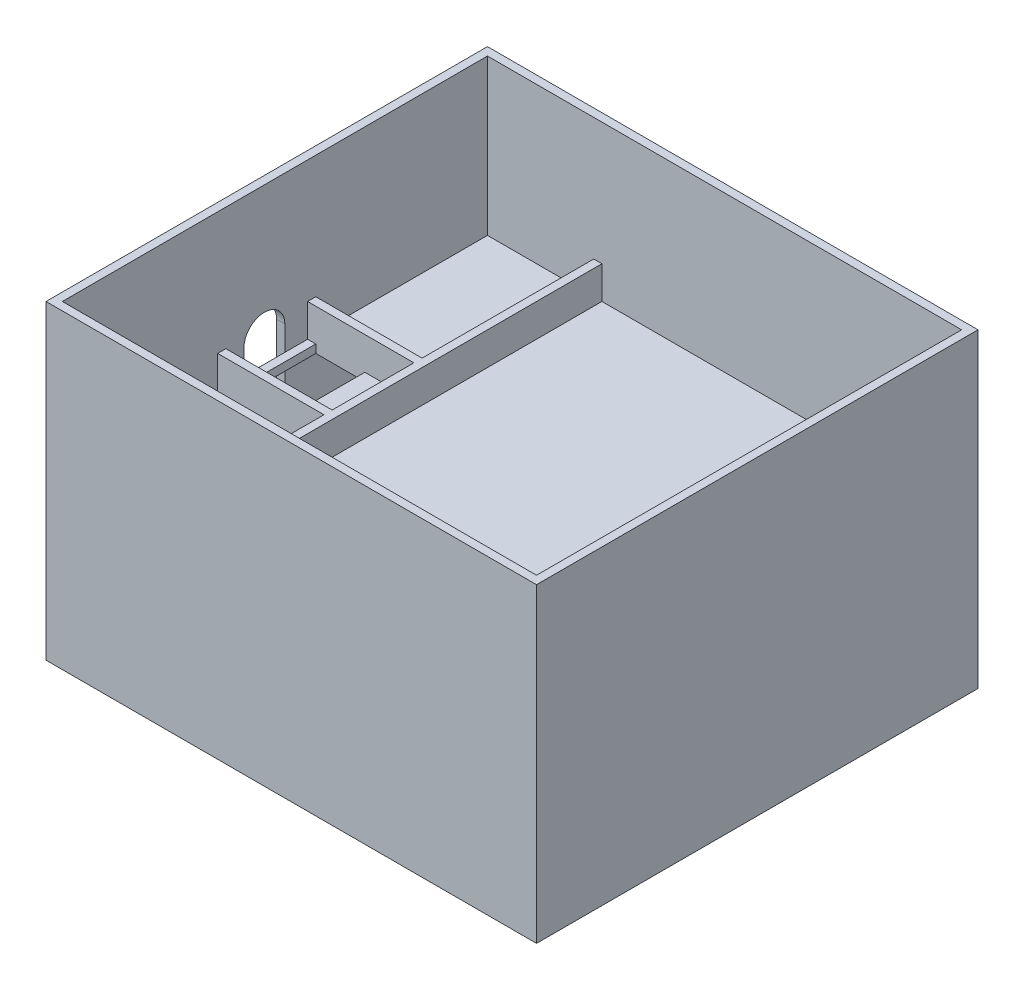
from build123d import *

# Parameters (mm, degrees)
SKETCH1_W           = 60
SKETCH1_H           = 54
BOSS_EXTRUDE1_DEPTH = 38
SKETCH2_W           = 44
SKETCH2_H           = 52
CUT_EXTRUDE1_DEPTH  = 19
SKETCH3_W           = 35
SKETCH3_H           = 52
CUT_EXTRUDE2_DEPTH  = 18
SKETCH4_W           = 6
SKETCH4_H           = 10
CUT_EXTRUDE3_DEPTH  = 38
SKETCH5_W           = 14
SKETCH5_H           = 52
CUT_EXTRUDE5_DEPTH  = 15
SKETCH6_W           = 13
SKETCH6_H           = 52
CUT_EXTRUDE6_DEPTH  = 4
SKETCH8_W           = 15
SKETCH8_H           = 13
CUT_EXTRUDE7_DEPTH  = 6
SKETCH10_W          = 13
SKETCH10_H          = 5
CUT_EXTRUDE8_DEPTH  = 6
SKETCH11_W          = 4
SKETCH11_H          = 5
CUT_EXTRUDE9_DEPTH  = 3
SKETCH12_W          = 5
SKETCH12_H          = 2
CUT_EXTRUDE10_DEPTH = 13
CUT_EXTRUDE11_DEPTH = 1
SKETCH14_W          = 13
SKETCH14_H          = 1
BOSS_EXTRUDE2_DEPTH = 4
SKETCH15_W          = 13
SKETCH15_H          = 1
BOSS_EXTRUDE3_DEPTH = 4


with BuildPart() as part:
    # Sketch1 → Boss-Extrude1 (new body)
    with BuildSketch(Plane(origin=(0, 0, 0), x_dir=(1, 0, 0), z_dir=(0, 1, 0))):
        with Locations((-83.874465942, -33.946435202)):
            Rectangle(SKETCH1_W, SKETCH1_H)
    extrude(amount=BOSS_EXTRUDE1_DEPTH)

    # Sketch2 → Cut-Extrude1 (cut)
    with BuildSketch(Plane(origin=(0, 38, 0), x_dir=(1, 0, 0), z_dir=(0, 1, 0))):
        with Locations((-76.874465942, -33.946435202)):
            Rectangle(SKETCH2_W, SKETCH2_H)
    extrude(amount=-CUT_EXTRUDE1_DEPTH, mode=Mode.SUBTRACT)

    # Sketch3 → Cut-Extrude2 (cut)
    with BuildSketch(Plane(origin=(0, 0, 0), x_dir=(-1, 0, 0), z_dir=(0, -1, 0))):
        with Locations((95.374465942, -33.946435202)):
            Rectangle(SKETCH3_W, SKETCH3_H)
    extrude(amount=-CUT_EXTRUDE2_DEPTH, mode=Mode.SUBTRACT)

    # Sketch4 → Cut-Extrude3 (cut)
    with BuildSketch(Plane(origin=(0, 18, 0), x_dir=(-1, 0, 0), z_dir=(0, -1, 0))):
        with Locations((108.874465942, -34.946435202)):
            Rectangle(SKETCH4_W, SKETCH4_H)
    extrude(amount=-CUT_EXTRUDE3_DEPTH, mode=Mode.SUBTRACT)

    # Sketch5 → Cut-Extrude5 (cut)
    with BuildSketch(Plane(origin=(0, 38, 0), x_dir=(1, 0, 0), z_dir=(0, 1, 0))):
        with Locations((-105.874465942, -33.946435202)):
            Rectangle(SKETCH5_W, SKETCH5_H)
    extrude(amount=-CUT_EXTRUDE5_DEPTH, mode=Mode.SUBTRACT)

    # Sketch6 → Cut-Extrude6 (cut)
    with BuildSketch(Plane(origin=(0, 23, 0), x_dir=(1, 0, 0), z_dir=(0, 1, 0))):
        with Locations((-106.374465942, -33.946435202)):
            Rectangle(SKETCH6_W, SKETCH6_H)
    extrude(amount=-CUT_EXTRUDE6_DEPTH, mode=Mode.SUBTRACT)

    # Sketch8 → Cut-Extrude7 (cut)
    with BuildSketch(Plane(origin=(0, 0, 0), x_dir=(-1, 0, 0), z_dir=(0, -1, 0))):
        with Locations((65.874465942, -17.946435202)):
            Rectangle(SKETCH8_W, SKETCH8_H)
    extrude(amount=-CUT_EXTRUDE7_DEPTH, mode=Mode.SUBTRACT)

    # Sketch10 → Cut-Extrude8 (cut)
    with BuildSketch(Plane(origin=(-73.374465942, 0, 0), x_dir=(0, 0, -1), z_dir=(1, 0, 0))):
        with Locations((-17.946435202, 3.5)):
            Rectangle(SKETCH10_W, SKETCH10_H)
    extrude(amount=-CUT_EXTRUDE8_DEPTH, mode=Mode.SUBTRACT)

    # Sketch11 → Cut-Extrude9 (cut)
    with BuildSketch(Plane.XZ):
        with Locations((-65.874465942, 48.446435202)):
            Rectangle(SKETCH11_W, SKETCH11_H)
    extrude(amount=-CUT_EXTRUDE9_DEPTH, mode=Mode.SUBTRACT)

    # Sketch12 → Cut-Extrude10 (cut)
    with BuildSketch(Plane(origin=(-67.874465942, 0, 0), x_dir=(0, 0, -1), z_dir=(1, 0, 0))):
        with Locations((-48.446435202, 2)):
            Rectangle(SKETCH12_W, SKETCH12_H)
    extrude(amount=-CUT_EXTRUDE10_DEPTH, mode=Mode.SUBTRACT)

    # Sketch13 → Cut-Extrude11 (cut)
    with BuildSketch(Plane.ZY.offset(113.874465942)):
        with BuildLine():
            Line((32.733045904, 15), (32.733045904, 22))
            ThreePointArc((32.733045904, 22), (35.233045904, 24.5), (37.733045904, 22))
            Line((37.733045904, 22), (37.733045904, 15))
            ThreePointArc((37.733045904, 15), (35.233045904, 12.5), (32.733045904, 15))
        make_face()
    extrude(amount=-CUT_EXTRUDE11_DEPTH, mode=Mode.SUBTRACT)

    # Sketch14 → Boss-Extrude2 (add)
    with BuildSketch(Plane(origin=(0, 19, 0), x_dir=(1, 0, 0), z_dir=(0, 1, 0))):
        with Locations((-106.374465942, -40.446435202)):
            Rectangle(SKETCH14_W, SKETCH14_H)
    extrude(amount=BOSS_EXTRUDE2_DEPTH)

    # Sketch15 → Boss-Extrude3 (add)
    with BuildSketch(Plane(origin=(0, 19, 0), x_dir=(1, 0, 0), z_dir=(0, 1, 0))):
        with Locations((-106.374465942, -29.446435202)):
            Rectangle(SKETCH15_W, SKETCH15_H)
    extrude(amount=BOSS_EXTRUDE3_DEPTH)


solid = part.part
